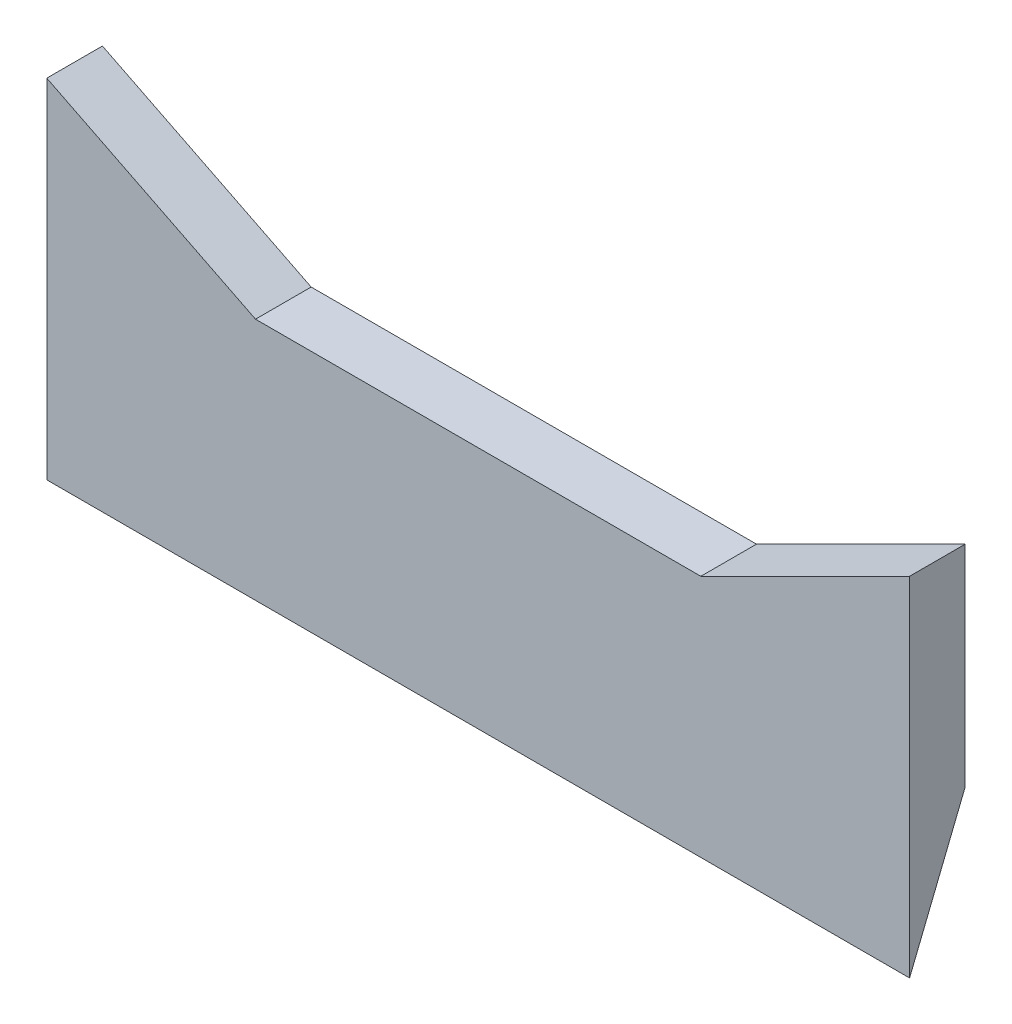
from build123d import *

# Parameters (mm, degrees)
RESSALTO_EXTRUS_O1_DEPTH = 8
CORTE_EXTRUS_O1_DEPTH    = 134.940285202


with BuildPart() as part:
    # Esboço1 → Ressalto-extrusão1 (new body)
    with BuildSketch(Plane.XY):
        Polygon((0, 0), (124, 0), (124, 50), (94, 35), (30, 35), (0, 50), align=None)
    extrude(amount=RESSALTO_EXTRUS_O1_DEPTH)

    # Esboço2 → Corte-extrusão1 (cut, through all)
    with BuildSketch(Plane.ZY):
        Polygon((8, 0), (0, 0), (0, 19.800694827), align=None)
    extrude(amount=-CORTE_EXTRUS_O1_DEPTH, mode=Mode.SUBTRACT)


solid = part.part
